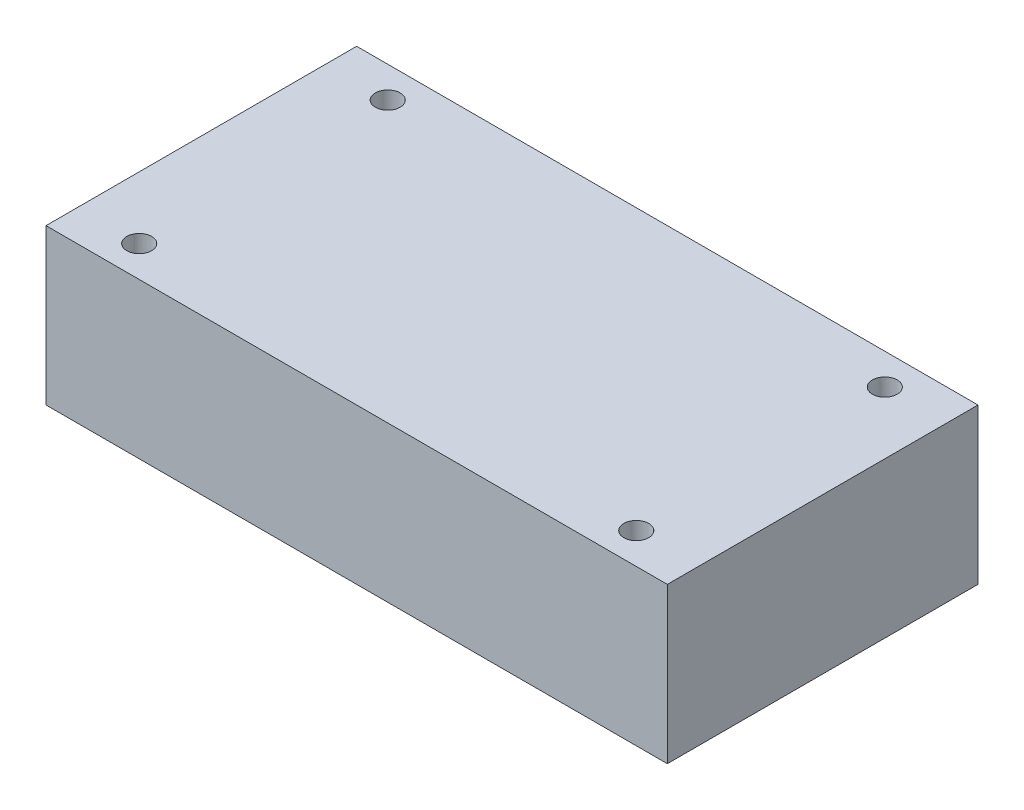
from build123d import *

# Parameters (mm, degrees)
SKETCH_1_W          = 100
SKETCH_1_H          = 50
EXTRUDE_1_DEPTH     = 25
SKETCH_2_R          = 2
CUT_EXTRUDE_1_DEPTH = 115.564392374


with BuildPart() as part:
    # 草图1 → 凸台-拉伸1 (new body)
    with BuildSketch(Plane(origin=(0, 0, 0), x_dir=(1, 0, 0), z_dir=(0, 1, 0))):
        with Locations((50, 25)):
            Rectangle(SKETCH_1_W, SKETCH_1_H)
    extrude(amount=EXTRUDE_1_DEPTH)

    # 草图2 → 切除-拉伸1 (cut, through all)
    with BuildSketch(Plane(origin=(0, 25, 0), x_dir=(1, 0, 0), z_dir=(0, 1, 0))):
        with Locations(Location((10, 5, 0), (0, 0, 270))):
            Circle(SKETCH_2_R)
        with Locations(Location((90, 5, 0), (0, 0, 270))):
            Circle(SKETCH_2_R)
        with Locations(Location((10, 45, 0), (0, 0, 270))):
            Circle(SKETCH_2_R)
        with Locations(Location((90, 45, 0), (0, 0, 270))):
            Circle(SKETCH_2_R)
    extrude(amount=-CUT_EXTRUDE_1_DEPTH, mode=Mode.SUBTRACT)


solid = part.part
